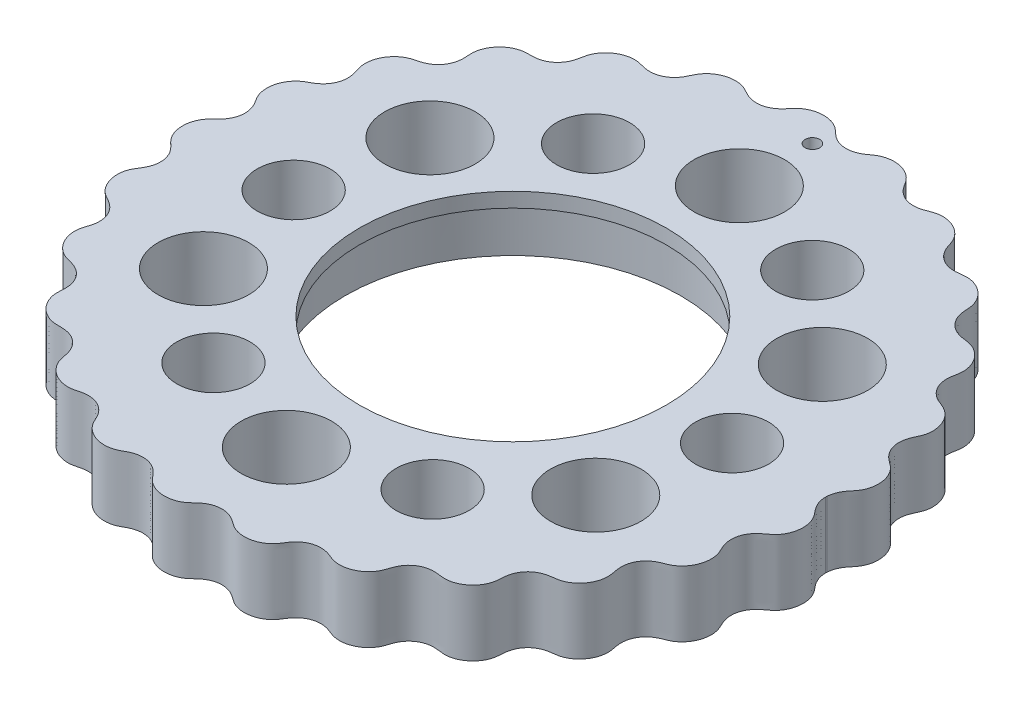
from build123d import *

# Parameters (mm, degrees)
BOSS_EXTRUDE1_DEPTH = 4.5
SKETCH2_R           = 11.475
CUT_EXTRUDE1_DEPTH  = 4.5
SKETCH3_R           = 3.1
CUT_EXTRUDE2_DEPTH  = 4.5
CIRPATTERN1_COUNT   = 6
SKETCH5_R           = 2.5
CUT_EXTRUDE3_DEPTH  = 4.5
CIRPATTERN2_COUNT   = 6
SKETCH6_R           = 11.737579432
SKETCH6_R_2         = 10.5
BOSS_EXTRUDE2_DEPTH = 1
SKETCH7_R           = 0.5
CUT_EXTRUDE4_DEPTH  = 4.5


with BuildPart() as part:
    # Sketch1 → Boss-Extrude1 (new body)
    with BuildSketch(Plane(origin=(0, 0, 0), x_dir=(1, 0, 0), z_dir=(0, 1, 0))):
        with BuildLine():
            add(Edge.make_bspline(
                [(21.4, 0), (21.4, -0.024056593), (21.40125708, -0.072797292), (21.40691199, -0.173196549), (21.421945314, -0.277745309), (21.444343725, -0.38896829), (21.474007496, -0.496769575), (21.519713196, -0.62937633), (21.596819477, -0.80192115), (21.718429718, -1.007979728), (21.897966119, -1.231918288), (22.100558232, -1.464478764), (22.283170777, -1.768982234), (22.413391042, -2.147904045), (22.461713132, -2.588752615), (22.401483161, -3.069654829), (22.246689202, -3.48571481), (22.028053447, -3.822650487), (21.770122338, -4.079849652), (21.501387326, -4.261718958), (21.221864249, -4.47651047), (20.965754362, -4.761223128), (20.767271444, -5.12137532), (20.662223859, -5.547891231), (20.669831597, -5.951738188), (20.757953256, -6.309094285), (20.890463471, -6.613993628), (21.026522729, -6.87990214), (21.136614202, -7.217211843), (21.17777615, -7.625780398), (21.118366515, -8.078184256), (20.935555274, -8.544040875), (20.676185281, -8.914331259), (20.37815472, -9.18654116), (20.097499086, -9.349166486), (19.869949477, -9.438358488), (19.642797004, -9.527181816), (19.396110322, -9.643059307), (19.111644734, -9.834945816), (18.832043332, -10.137911858), (18.62796647, -10.526669679), (18.53870404, -10.919918375), (18.537903592, -11.286445782), (18.592040298, -11.613079828), (18.656602697, -11.903472831), (18.6769681, -12.256316982), (18.613701834, -12.660266561), (18.445433186, -13.075071467), (18.162717158, -13.46839806), (17.832817974, -13.757839952), (17.526082418, -13.929543725), (17.261113567, -14.020659613), (17.055632097, -14.063095703), (16.889404969, -14.084724158), (16.681437024, -14.109043543), (16.404528364, -14.158640038), (16.069383627, -14.275269076), (15.708969864, -14.508722648), (15.404776587, -14.853825114), (15.220001393, -15.236519026), (15.145054893, -15.576552022), (15.123480362, -15.847220466), (15.111665393, -16.082776753), (15.085952864, -16.318027594), (15.004750021, -16.617655069), (14.832741666, -16.960816184), (14.572843395, -17.288179979), (14.222803418, -17.573032638), (13.844309991, -17.763286952), (13.46187357, -17.862743857), (13.137528244, -17.876861263), (12.88644673, -17.846595838), (12.636531933, -17.81285656), (12.354660141, -17.793592318), (11.999939931, -17.825993863), (11.593339756, -17.966478574), (11.21552848, -18.22859864), (10.944859624, -18.55502764), (10.79057614, -18.865524099), (10.703824048, -19.121648193), (10.633851518, -19.34598573), (10.549446754, -19.566140598), (10.395362766, -19.83426858), (10.143219722, -20.121599551), (9.80680376, -20.374816566), (9.389032603, -20.564603213), (8.969182101, -20.651511086), (8.57239876, -20.646529509), (8.21985143, -20.566980597), (7.922986458, -20.437892876), (7.584248031, -20.314166304), (7.189260098, -20.249548808), (6.756233498, -20.284899351), (6.319306191, -20.450422995), (5.976141932, -20.703781361), (5.752224288, -20.966683217), (5.606073639, -21.1928263), (5.482697339, -21.391855018), (5.345524694, -21.582593744), (5.129260459, -21.801905925), (4.813862618, -22.015317289), (4.425325735, -22.175317402), (3.973102375, -22.254019035), (3.54428038, -22.232225396), (3.159766445, -22.126788809), (2.874555191, -21.978070295), (2.677882694, -21.83413788), (2.481616479, -21.69029157), (2.244773079, -21.539611613), (1.913553813, -21.396849899), (1.480174143, -21.326885969), (1.008915064, -21.3849391), (0.613921563, -21.553552748), (0.304283336, -21.778915422), (0.063769492, -22.016683463), (-0.157841276, -22.214247034), (-0.448044558, -22.3889205), (-0.803976677, -22.51951218), (-1.223624029, -22.579845958), (-1.688804258, -22.542974687), (-2.103041989, -22.41234084), (-2.44953521, -22.212360255), (-2.719155571, -21.967429181), (-2.917030681, -21.708128299), (-3.159443039, -21.437095205), (-3.480431644, -21.193069713), (-3.895513615, -21.016224575), (-4.326614986, -20.968771559), (-4.698617845, -21.019861046), (-5.0064414, -21.123986025), (-5.247301492, -21.24079026), (-5.48210519, -21.381012328), (-5.737698692, -21.498210281), (-6.048518235, -21.581202173), (-6.409810205, -21.609851882), (-6.818074402, -21.561123686), (-7.251385598, -21.409842991), (-7.61660263, -21.180786311), (-7.902563792, -20.898519084), (-8.101534991, -20.591817032), (-8.228460601, -20.289964565), (-8.398482492, -19.966873943), (-8.651961107, -19.65137424), (-9.0130821, -19.379787839), (-9.420172408, -19.230414338), (-9.792782099, -19.19077414), (-10.115241396, -19.217196078), (-10.376185743, -19.271668806), (-10.63755606, -19.348685801), (-10.913690143, -19.396666021), (-11.234139357, -19.398105121), (-11.589613488, -19.334703747), (-11.971704676, -19.185039822), (-12.353176405, -18.929617746), (-12.649322401, -18.615401519), (-12.855663123, -18.26856562), (-12.970075822, -17.920036192), (-13.017772481, -17.594662481), (-13.132278474, -17.122566776), (-13.398695431, -16.651145724), (-13.807530545, -16.317448363), (-14.271271537, -16.148922285), (-14.589478954, -16.096608686), (-14.854453817, -16.086058751), (-15.125923555, -16.095335437), (-15.404161371, -16.071425823), (-15.713350155, -15.991857956), (-16.040018375, -15.841219255), (-16.371529953, -15.600614474), (-16.676603085, -15.257416242), (-16.884365033, -14.878054825), (-16.996865395, -14.488735497), (-17.018663233, -14.121212275), (-16.983283983, -13.793026902), (-16.979684749, -13.305329879), (-17.125033637, -12.782694254), (-17.442146056, -12.360393768), (-17.851404756, -12.085641038), (-18.14619101, -11.958380373), (-18.399510483, -11.883942253), (-18.663742909, -11.825296666), (-18.925822459, -11.731548027), (-19.203690957, -11.57677212), (-19.480635968, -11.349299896), (-19.740449774, -11.033534352), (-19.949452223, -10.624609785), (-20.055152363, -10.204361502), (-20.065600395, -9.797679008), (-19.992837924, -9.435293963), (-19.875817434, -9.125497104), (-19.783999964, -8.767534975), (-19.76149022, -8.359017231), (-19.851488197, -7.914209917), (-20.056478219, -7.532436632), (-20.306688253, -7.256767468), (-20.560406411, -7.063038174), (-20.787197148, -6.929481192), (-21.027371479, -6.807139368), (-21.256199661, -6.650124926), (-21.484912696, -6.430799323), (-21.694536313, -6.141785003), (-21.86630886, -5.771394721), (-21.96559233, -5.323066623), (-21.962343921, -4.888847464), (-21.878340879, -4.53214987), (-21.761341555, -4.270584255), (-21.63352147, -4.056497398), (-21.494941564, -3.849580149), (-21.337532051, -3.56023981), (-21.2169509, -3.167685805), (-21.197379834, -2.713744204), (-21.304948305, -2.293994242), (-21.481076224, -1.967039528), (-21.679419984, -1.718700557), (-21.865973331, -1.534662541), (-22.067141513, -1.356674207), (-22.247811602, -1.147164589), (-22.412867632, -0.878040051), (-22.542147717, -0.546597775), (-22.61725644, -0.133488281), (-22.59588731, 0.350634871), (-22.466123621, 0.791838192), (-22.267596727, 1.129802185), (-22.067696794, 1.350994912), (-21.916474048, 1.49105573), (-21.795982359, 1.603737134), (-21.652436133, 1.751974072), (-21.480912501, 1.968265229), (-21.314519838, 2.272994573), (-21.205474628, 2.682938874), (-21.210622104, 3.141176169), (-21.32617992, 3.540769781), (-21.503322976, 3.86651873), (-21.684768417, 4.131977912), (-21.814809694, 4.374716785), (-21.918287828, 4.679830092), (-21.970922506, 5.045676275), (-21.945154696, 5.472433161), (-21.80709346, 5.937259905), (-21.600122914, 6.293603685), (-21.374642068, 6.544492929), (-21.177794138, 6.703004522), (-21.036001886, 6.796486918), (-20.850507135, 6.898924844), (-20.626393818, 7.019148797), (-20.357343685, 7.206177298), (-20.081332468, 7.497464761), (-19.865676432, 7.88262472), (-19.771123487, 8.290087424), (-19.774189738, 8.652555552), (-19.83182387, 8.962210039), (-19.908402111, 9.210519203), (-19.997048361, 9.462109998), (-20.050685376, 9.731724574), (-20.062456446, 10.044970879), (-20.013529765, 10.394655256), (-19.872314727, 10.80809823), (-19.634201143, 11.184546784), (-19.343154376, 11.477701919), (-19.046991918, 11.669933439), (-18.818645961, 11.772630264), (-18.604552686, 11.837007885), (-18.413222215, 11.882652846), (-18.175963945, 11.948427492), (-17.90086558, 12.058300268), (-17.592849612, 12.25160437), (-17.294832127, 12.562007295), (-17.094131407, 12.928279478), (-16.993669397, 13.317810425), (-16.978446056, 13.64606843), (-16.996527548, 13.900391283), (-17.009914298, 14.112418548), (-17.007597186, 14.282664718), (-16.980105646, 14.534555487), (-16.889882702, 14.860504114), (-16.700561669, 15.227038526), (-16.382847463, 15.593339588), (-16.037333208, 15.844248152), (-15.701616369, 15.996482344), (-15.389642888, 16.073562612), (-15.115755738, 16.095053836), (-14.852951026, 16.086220425), (-14.600250027, 16.09643325), (-14.303568978, 16.142539069), (-13.973984224, 16.25295047), (-13.627451007, 16.465553713), (-13.333734192, 16.78485279), (-13.142948482, 17.13734534), (-13.048803253, 17.450902115), (-13.003971199, 17.700956825), (-12.963723883, 17.908813813), (-12.918446519, 18.072326684), (-12.828275639, 18.308170917), (-12.659167142, 18.599655533), (-12.384060358, 18.906245368), (-11.984436232, 19.180872702), (-11.586199089, 19.336985157), (-11.221566431, 19.399613296), (-10.899077099, 19.395031819), (-10.627925889, 19.345848062), (-10.374717103, 19.271540811), (-10.126095671, 19.21966685), (-9.825706247, 19.192400427), (-9.481881801, 19.220130446), (-9.100764084, 19.340278645), (-8.74531042, 19.571454146), (-8.507670437, 19.824116105), (-8.355534799, 20.054116726), (-8.259222569, 20.236380973), (-8.189450138, 20.385687169), (-8.102938549, 20.57255677), (-7.954083939, 20.8305437), (-7.693905847, 21.123162216), (-7.314354454, 21.382441326), (-6.860424211, 21.551996004), (-6.444100436, 21.607892875), (-6.088595916, 21.586930392), (-5.781439083, 21.512635881), (-5.526314109, 21.405005485), (-5.29474701, 21.26844266), (-5.061608014, 21.148034415), (-4.763608214, 21.036571599), (-4.397779577, 20.970836428), (-3.965488812, 20.999446345), (-3.540190469, 21.159139257), (-3.205190516, 21.395866235), (-2.95019366, 21.664828609), (-2.750993673, 21.930489218), (-2.484549796, 22.188040986), (-2.135158882, 22.398777182), (-1.723539019, 22.535904927), (-1.26628773, 22.579480695), (-0.860899206, 22.530316812), (-0.520976017, 22.419692543), (-0.241668623, 22.269462176), (-0.02170729, 22.099792533), (0.168941721, 21.908923393), (0.366524598, 21.734568012), (0.629820375, 21.553384644), (0.969883557, 21.401312816), (1.396537146, 21.32539099), (1.847079027, 21.378356692), (2.227976178, 21.526625622), (2.539367857, 21.72487764), (2.797650649, 21.9316068), (3.119821845, 22.112038669), (3.509525058, 22.227210958), (3.941690232, 22.256136806), (4.395112138, 22.183378754), (4.775754715, 22.0334681), (5.07777526, 21.839809394), (5.310750318, 21.622862488), (5.480728607, 21.402021271), (5.618069758, 21.168685553), (5.767849895, 20.950529614), (5.980365334, 20.709870263), (6.274571275, 20.480045557), (6.670672751, 20.303985885), (7.120123383, 20.247460154), (7.524097401, 20.299148427), (7.872885152, 20.415434854), (8.173541462, 20.550490013), (8.529786627, 20.642452472), (8.934279152, 20.655388115), (9.35906009, 20.574612907), (9.779532779, 20.390243921), (10.110775513, 20.148892955), (10.354927935, 19.88420713), (10.525938545, 19.614250511), (10.634343415, 19.35653205), (10.709321305, 19.095328813), (10.801865543, 18.84621759), (10.950438613, 18.559979499), (11.18132221, 18.265582324), (11.523739319, 17.999631248), (11.945915188, 17.837237408), (12.348945422, 17.789990107), (12.714047487, 17.818024669), (13.037726108, 17.87325972), (13.404298143, 17.871333967), (13.797306067, 17.782030788), (14.187344514, 17.597139362), (14.547877239, 17.313050391), (14.808161907, 16.995500147), (14.978099428, 16.676511913), (15.075444096, 16.370834419), (15.114680861, 16.093071292), (15.122165396, 15.820410725), (15.151428746, 15.555143874), (15.226625091, 15.240062746), (15.380381214, 14.89811293), (15.649114328, 14.55776787), (16.019510282, 14.299283106), (16.397798733, 14.156612545), (16.757331605, 14.095410164), (17.083250816, 14.067804314), (17.435938274, 13.972799161), (17.792083703, 13.787898406), (18.125445267, 13.508625707), (18.406613273, 13.136175484), (18.581196624, 12.750500648), (18.662608117, 12.381293854), (18.671934473, 12.043683165), (18.625340657, 11.751182618), (18.553018555, 11.421822718), (18.526834481, 11.040918335), (18.593334316, 10.617390795), (18.793816561, 10.187032971), (19.083220044, 9.856483912), (19.414752074, 9.627490729), (19.74721655, 9.481415946), (20.054617099, 9.373229786), (20.370205969, 9.192126846), (20.666845294, 8.924358576), (20.918635819, 8.570697307), (21.097121092, 8.139544084), (21.169080729, 7.721507576), (21.154402084, 7.342249842), (21.077380869, 7.012045528), (20.957391538, 6.740163122), (20.805659027, 6.437547797), (20.68754625, 6.072698876), (20.650247231, 5.644696489), (20.741861132, 5.178570007), (20.943238746, 4.78895604), (21.208670681, 4.487766534), (21.494491104, 4.266229919), (21.763781662, 4.084854635), (22.021739734, 3.830309301), (22.240237925, 3.497593232), (22.39301217, 3.096385501), (22.45756737, 2.642043936), (22.425065275, 2.222826295), (22.319026048, 1.856687557), (22.176707006, 1.583136287), (22.037252044, 1.393780171), (21.91109702, 1.244664915), (21.811945326, 1.123750225), (21.708566924, 0.98383379), (21.622612519, 0.845131874), (21.553998505, 0.708939848), (21.501235212, 0.577848336), (21.46592229, 0.469942992), (21.441355377, 0.374331782), (21.424970954, 0.292223102), (21.414290635, 0.219927472), (21.407518232, 0.159260172), (21.404038716, 0.117106787), (21.402526089, 0.092443044), (21.401939754, 0.080310922)],
                knots=[0.070289989, 0.070289989, 0.070289989, 0.070289989, 0.070289989, 0.070911185, 0.071532382, 0.072153579, 0.072774775, 0.073395972, 0.074017168, 0.075259561, 0.07696753, 0.078675499, 0.080383467, 0.082091436, 0.084794744, 0.087498052, 0.090124883, 0.092751714, 0.094549165, 0.096346615, 0.098144066, 0.099941516, 0.102357571, 0.104773625, 0.107171899, 0.109570172, 0.111225632, 0.112881091, 0.11453655, 0.11619201, 0.119052824, 0.121913638, 0.124550545, 0.127187452, 0.128992402, 0.130797352, 0.131699827, 0.132602302, 0.134407252, 0.136832113, 0.139256974, 0.141646265, 0.144035556, 0.145684239, 0.147332923, 0.148981606, 0.15063029, 0.153479755, 0.156329219, 0.158805086, 0.161280952, 0.163139881, 0.164069346, 0.16499881, 0.165928275, 0.166857739, 0.168716669, 0.171228588, 0.173740507, 0.176268341, 0.178796174, 0.180541641, 0.181414375, 0.182287109, 0.184032576, 0.185778044, 0.188261616, 0.190745188, 0.193230401, 0.195715614, 0.197582288, 0.199448961, 0.200382298, 0.201315635, 0.203182308, 0.205703189, 0.208224071, 0.210741132, 0.213258193, 0.214997172, 0.215866661, 0.216736151, 0.21847513, 0.220214109, 0.222687627, 0.225161145, 0.227739659, 0.230318173, 0.232111255, 0.233904337, 0.235697418, 0.2374905, 0.240099125, 0.24270775, 0.245213932, 0.247720113, 0.249452692, 0.250318982, 0.251185271, 0.25291785, 0.254650429, 0.257113891, 0.259577352, 0.262166073, 0.264754795, 0.266555011, 0.268355227, 0.269255335, 0.270155443, 0.27195566, 0.274573459, 0.277191259, 0.279768583, 0.282345907, 0.283988426, 0.285630945, 0.287273464, 0.288915982, 0.291454924, 0.293993866, 0.296592737, 0.299191608, 0.300998943, 0.302806277, 0.304613611, 0.306420945, 0.309047909, 0.311674873, 0.314492145, 0.315900781, 0.317309416, 0.318862905, 0.320416393, 0.321969881, 0.323523369, 0.325966731, 0.328410094, 0.331019052, 0.333628009, 0.335442437, 0.337256865, 0.339071293, 0.34088572, 0.343521843, 0.346157966, 0.348962466, 0.350364716, 0.351766966, 0.353315064, 0.354863162, 0.35641126, 0.357959358, 0.360392844, 0.36282633, 0.365445306, 0.368064282, 0.369885771, 0.371707261, 0.37352875, 0.375350239, 0.380640802, 0.383432381, 0.38482817, 0.386223959, 0.387766638, 0.389309317, 0.390851996, 0.392394675, 0.394818624, 0.397242573, 0.399871494, 0.402500415, 0.404328926, 0.406157437, 0.407985948, 0.409814459, 0.415123345, 0.417901857, 0.419291114, 0.42068037, 0.422217766, 0.423755162, 0.425292559, 0.426829955, 0.429244387, 0.431658819, 0.434297607, 0.436936394, 0.438771881, 0.440607368, 0.442442854, 0.444278341, 0.446941951, 0.449605562, 0.452370869, 0.453753523, 0.455136177, 0.456668428, 0.45820068, 0.459732932, 0.461265184, 0.463670125, 0.466075066, 0.468723637, 0.471372208, 0.473214618, 0.474135823, 0.475057027, 0.476899437, 0.478741847, 0.481414633, 0.48408742, 0.486839389, 0.488215373, 0.489591357, 0.491118606, 0.492645854, 0.494173102, 0.49570035, 0.498095831, 0.500491312, 0.503422157, 0.506353003, 0.508182885, 0.509097826, 0.510012767, 0.510927708, 0.511842649, 0.513672532, 0.516120493, 0.518568455, 0.52114213, 0.523715805, 0.525237059, 0.526758313, 0.528279567, 0.529800821, 0.532353844, 0.534906866, 0.537684502, 0.540462137, 0.541402408, 0.542342678, 0.543282949, 0.544223219, 0.54610376, 0.547984301, 0.550516682, 0.553049063, 0.555774599, 0.557137367, 0.558500134, 0.560017494, 0.561534853, 0.563052212, 0.564569572, 0.566946245, 0.569322917, 0.572675218, 0.574351368, 0.576027518, 0.577119137, 0.578210755, 0.579302374, 0.580393992, 0.582577229, 0.584760466, 0.587299503, 0.58983854, 0.591723927, 0.593609313, 0.594552007, 0.5954947, 0.596437393, 0.597380086, 0.6001648, 0.602949514, 0.605495326, 0.608041138, 0.609558812, 0.611076486, 0.612594159, 0.614111833, 0.615394062, 0.616676291, 0.61924075, 0.621770613, 0.624300476, 0.626179202, 0.628057929, 0.628997292, 0.629936656, 0.630876019, 0.631815382, 0.634590349, 0.637365315, 0.639921047, 0.64247678, 0.643999395, 0.645522011, 0.647044627, 0.648567242, 0.649855801, 0.651144359, 0.653721475, 0.656167009, 0.658612543, 0.66044063, 0.661354674, 0.662268718, 0.663182761, 0.664096805, 0.665924892, 0.668852881, 0.671780871, 0.674178928, 0.676576986, 0.678105585, 0.679634184, 0.681162783, 0.682691382, 0.684069191, 0.685447001, 0.68820262, 0.690872904, 0.693543187, 0.695383714, 0.697224241, 0.699064768, 0.700905295, 0.703551206, 0.706197117, 0.708604644, 0.711012171, 0.712545812, 0.714079453, 0.715613094, 0.717146735, 0.718531196, 0.719915657, 0.72268458, 0.725345689, 0.728006799, 0.729840388, 0.731673977, 0.733507566, 0.735341155, 0.73797726, 0.740613364, 0.74303039, 0.745447415, 0.746986238, 0.748525062, 0.750063885, 0.751602708, 0.752993754, 0.754384799, 0.757166889, 0.759818833, 0.762470776, 0.764297377, 0.766123977, 0.767950577, 0.769777177, 0.772403394, 0.77502961, 0.777456158, 0.779882706, 0.78142685, 0.782970993, 0.784515137, 0.786059281, 0.787456839, 0.788854398, 0.791649515, 0.794292299, 0.796935082, 0.798754649, 0.800574216, 0.802393783, 0.80421335, 0.806829601, 0.809445851, 0.811881941, 0.814318031, 0.81586763, 0.81741723, 0.818966829, 0.820516428, 0.821920427, 0.823324427, 0.826132425, 0.82876605, 0.831399675, 0.833212171, 0.835024667, 0.836837163, 0.838649659, 0.841255872, 0.843862085, 0.846393456, 0.848924827, 0.8505631, 0.852201372, 0.853839645, 0.855477918, 0.858046895, 0.860615872, 0.863240337, 0.865864802, 0.867670197, 0.869475592, 0.871280987, 0.873086382, 0.875682491, 0.8782786, 0.880820382, 0.883362164, 0.88500629, 0.886650415, 0.888294541, 0.889938666, 0.892519105, 0.895099544, 0.897714843, 0.900330141, 0.902128413, 0.903926685, 0.905724956, 0.907523228, 0.910109171, 0.912695114, 0.915161318, 0.917627522, 0.919361838, 0.921096153, 0.921963311, 0.922830468, 0.923697626, 0.924564784, 0.925819363, 0.926446653, 0.927073943, 0.927701233, 0.928328523, 0.928642168, 0.928955813, 0.929269458, 0.929583103, 0.929583103, 0.929583103, 0.929583103, 0.929583103], degree=4))
            Line((21.401939754, 0.080310922), (21.4, 0))
        make_face()
    extrude(amount=BOSS_EXTRUDE1_DEPTH)

    # Sketch2 → Cut-Extrude1 (cut)
    with BuildSketch(Plane(origin=(0, 4.5, 0), x_dir=(1, 0, 0), z_dir=(0, 1, 0))):
        with Locations(Location((0, 0, 0), (0, 0, 270))):
            Circle(SKETCH2_R)
    extrude(amount=-CUT_EXTRUDE1_DEPTH, mode=Mode.SUBTRACT)

    # Sketch3 → Cut-Extrude2 (cut)
    with BuildSketch(Plane(origin=(0, 4.5, 0), x_dir=(1, 0, 0), z_dir=(0, 1, 0))):
        with Locations(Location((0, 15.5, 0), (0, 0, 270))):
            Circle(SKETCH3_R)
    cut_extrude2 = extrude(amount=-CUT_EXTRUDE2_DEPTH, mode=Mode.SUBTRACT)

    # CirPattern1: Cut-Extrude2 ×6 about axis
    cirpattern1_axis = Axis((0, 0, 0), (0, 1, 0))
    for i in range(1, CIRPATTERN1_COUNT):
        add(cut_extrude2.rotate(cirpattern1_axis, i * 360 / CIRPATTERN1_COUNT), mode=Mode.SUBTRACT)

    # Sketch5 → Cut-Extrude3 (cut)
    with BuildSketch(Plane(origin=(0, 4.5, 0), x_dir=(1, 0, 0), z_dir=(0, 1, 0))):
        with Locations(Location((-7.5, 12.990381057, 0), (0, 0, 270))):
            Circle(SKETCH5_R)
    cut_extrude3 = extrude(amount=-CUT_EXTRUDE3_DEPTH, mode=Mode.SUBTRACT)

    # CirPattern2: Cut-Extrude3 ×6 about axis
    cirpattern2_axis = Axis((0, 0, 0), (0, 1, 0))
    for i in range(1, CIRPATTERN2_COUNT):
        add(cut_extrude3.rotate(cirpattern2_axis, i * 360 / CIRPATTERN2_COUNT), mode=Mode.SUBTRACT)

    # Sketch6 → Boss-Extrude2 (add)
    with BuildSketch(Plane(origin=(0, 4.5, 0), x_dir=(1, 0, 0), z_dir=(0, 1, 0))):
        Circle(SKETCH6_R)
        with Locations(Location((0, 0, 0), (0, 0, 270))):
            Circle(SKETCH6_R_2, mode=Mode.SUBTRACT)
    extrude(amount=-BOSS_EXTRUDE2_DEPTH)

    # Sketch7 → Cut-Extrude4 (cut)
    with BuildSketch(Plane(origin=(0, 4.5, 0), x_dir=(1, 0, 0), z_dir=(0, 1, 0))):
        with Locations(Location((0, 20.5, 0), (0, 0, 270))):
            Circle(SKETCH7_R)
    extrude(amount=-CUT_EXTRUDE4_DEPTH, mode=Mode.SUBTRACT)


solid = part.part
